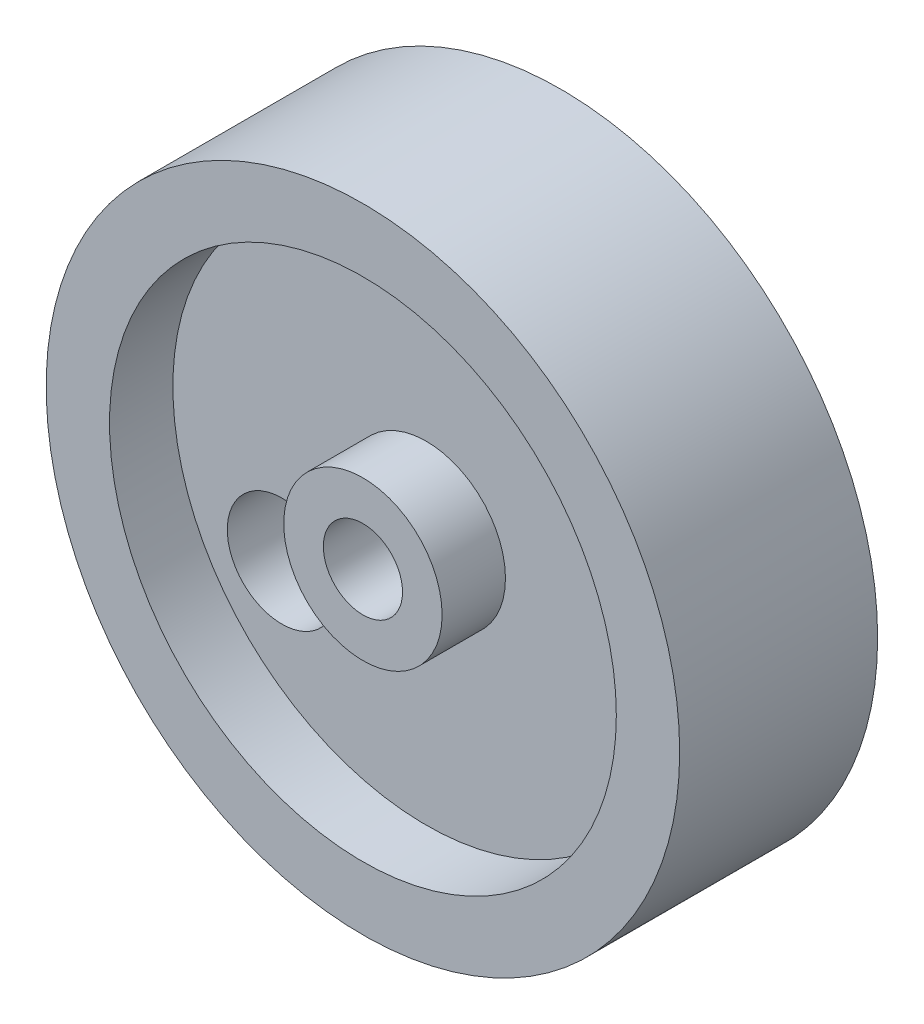
from build123d import *

# Parameters (mm, degrees)
SKETCH1_R           = 50.8
SKETCH1_R_2         = 6.35
BOSS_EXTRUDE1_DEPTH = 15.875
SKETCH2_R           = 40.64
SKETCH2_R_2         = 12.7
CUT_EXTRUDE1_DEPTH  = 10.16
CUT_EXTRUDE2_REACH  = 77.016
SKETCH3_R           = 8.758928998


with BuildPart() as part:
    # Sketch1 → Boss-Extrude1 (new, symmetric)
    with BuildSketch(Plane.XY):
        Circle(SKETCH1_R)
        Circle(SKETCH1_R_2, mode=Mode.SUBTRACT)
    extrude(amount=BOSS_EXTRUDE1_DEPTH, both=True)

    # Sketch2 → Cut-Extrude1 (cut)
    with BuildSketch(Plane.XY.offset(15.875)):
        Circle(SKETCH2_R)
        Circle(SKETCH2_R_2, mode=Mode.SUBTRACT)
    cut_extrude1 = extrude(amount=-CUT_EXTRUDE1_DEPTH, mode=Mode.SUBTRACT)

    # Mirror1: Cut-Extrude1 across plane
    add(cut_extrude1.mirror(Plane.XY), mode=Mode.SUBTRACT)

    # Sketch3 → Cut-Extrude2 (cut, up to next)
    with BuildSketch(Plane.XY.offset(5.715), mode=Mode.PRIVATE) as cut_extrude2_sk1:
        with Locations((-23.151287749, -15.527256866)):
            Circle(SKETCH3_R)
    cut_extrude2_tool1 = extrude(cut_extrude2_sk1.sketch, amount=-CUT_EXTRUDE2_REACH, mode=Mode.PRIVATE) & part.part
    add(cut_extrude2_tool1.solids().sort_by_distance((-23.151288, -15.527257, 5.715))[0], mode=Mode.SUBTRACT)


solid = part.part
